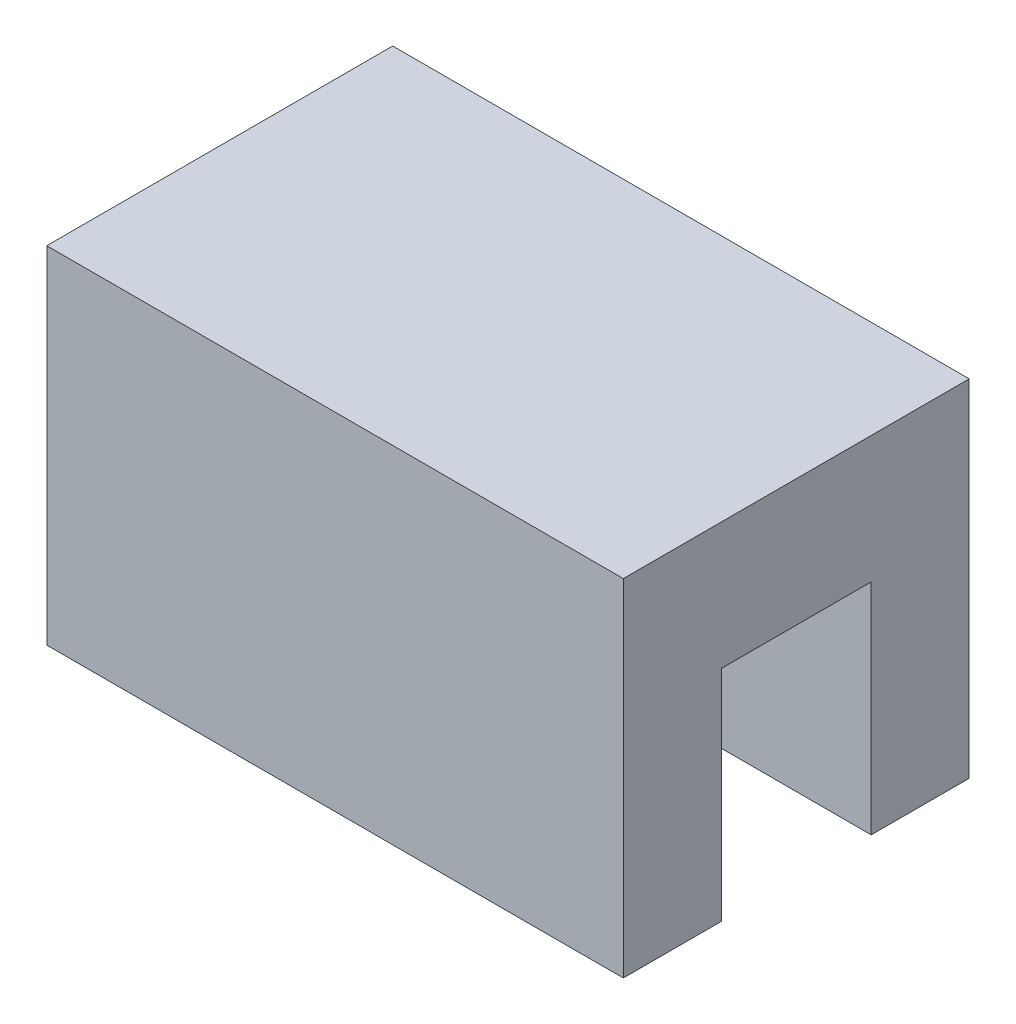
from build123d import *

# Parameters (mm, degrees)
SKETCH1_W           = 30
SKETCH1_H           = 30
BOSS_EXTRUDE1_DEPTH = 50
SKETCH2_W           = 13
SKETCH2_H           = 19
CUT_EXTRUDE1_DEPTH  = 18


with BuildPart() as part:
    # Sketch1 → Boss-Extrude1 (new body)
    with BuildSketch(Plane(origin=(0, 0, 0), x_dir=(0, 0, -1), z_dir=(1, 0, 0))):
        with Locations((15, 15)):
            Rectangle(SKETCH1_W, SKETCH1_H)
    extrude(amount=BOSS_EXTRUDE1_DEPTH)

    # Sketch2 → Cut-Extrude1 (cut)
    with BuildSketch(Plane(origin=(50, 0, 0), x_dir=(0, 0, -1), z_dir=(1, 0, 0))):
        with Locations((15, 9.5)):
            Rectangle(SKETCH2_W, SKETCH2_H)
    extrude(amount=-CUT_EXTRUDE1_DEPTH, mode=Mode.SUBTRACT)


solid = part.part
